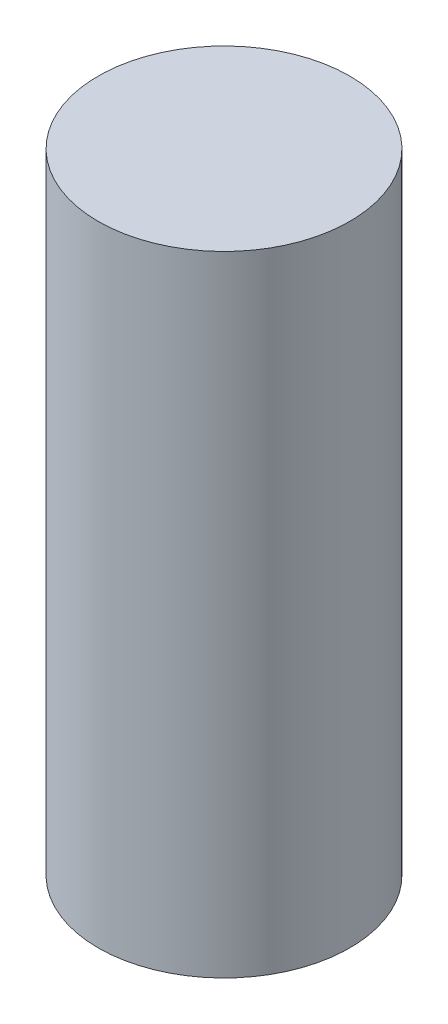
from build123d import *

# Parameters (mm, degrees)
SKETCH_1_R      = 3
EXTRUDE_1_DEPTH = 15


with BuildPart() as part:
    # 草图1 → 凸台-拉伸1 (new body)
    with BuildSketch(Plane(origin=(0, 0, 0), x_dir=(1, 0, 0), z_dir=(0, 1, 0))):
        with Locations(Location((0, 0, 0), (0, 0, 270))):
            Circle(SKETCH_1_R)
    extrude(amount=EXTRUDE_1_DEPTH)


solid = part.part
